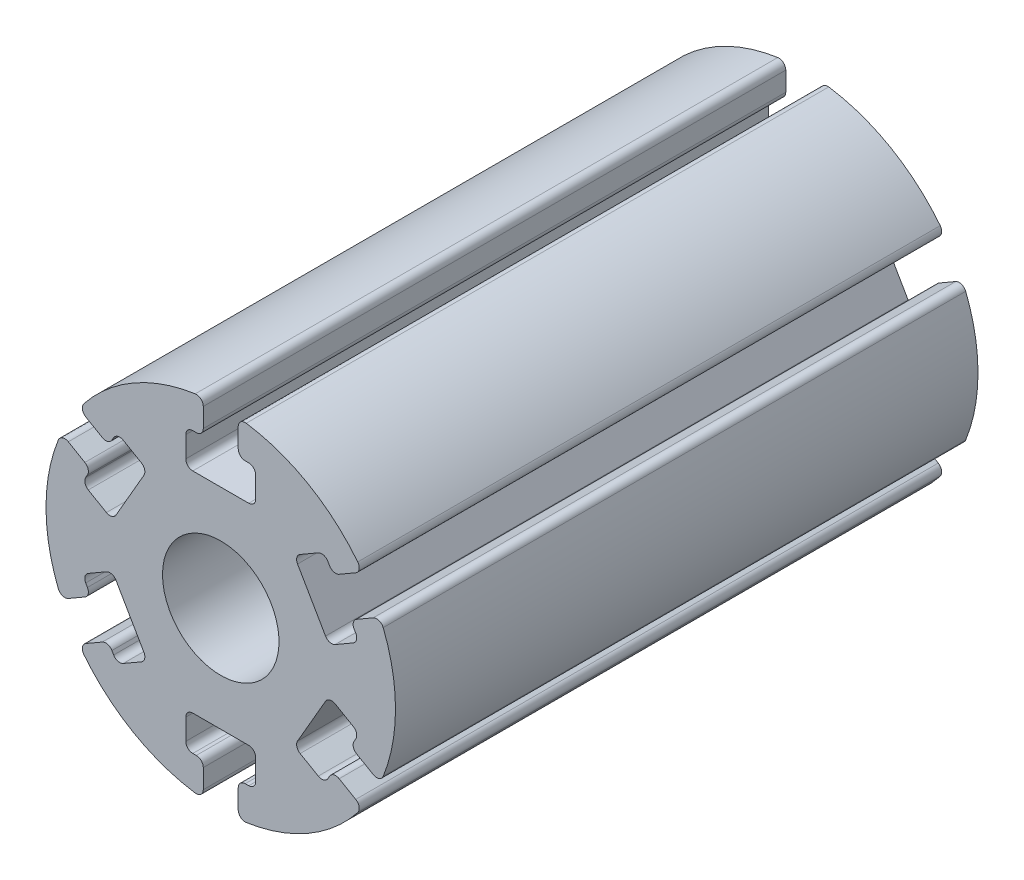
from build123d import *

# Parameters (mm, degrees)
ESBO_O1_R                = 7.5
RESSALTO_EXTRUS_O1_DEPTH = 12.5
ESBO_O7_R                = 2.5
CORTE_EXTRUS_O1_DEPTH    = 16
CORTE_EXTRUS_O2_DEPTH    = 28.156951228
FILETE2_R                = 0.3


with BuildPart() as part:
    # Esboço1 → Ressalto-extrusão1 (new, symmetric)
    with BuildSketch(Plane.XY):
        Circle(ESBO_O1_R)
    extrude(amount=RESSALTO_EXTRUS_O1_DEPTH, both=True)

    # Esboço7 → Corte-extrusão1 (cut)
    with BuildSketch(Plane(origin=(0, 0, 12.5), x_dir=(-1, 0, 0), z_dir=(0, 0, -1))):
        Circle(ESBO_O7_R)
    extrude(amount=CORTE_EXTRUS_O1_DEPTH, mode=Mode.SUBTRACT)

    # Esboço9 → Corte-extrusão2 (cut, through all)
    with BuildSketch(Plane.XY.offset(12.5)):
        Polygon((-0.75, 6), (-0.75, 7.5), (0.75, 7.5), (0.75, 6), (1.5, 6), (1.5, 4.5), (-1.5, 4.5), (-1.5, 6), align=None)
        Polygon((4.446152423, 4.299038106), (3.147114317, 3.549038106), (4.647114317, 0.950961894), (5.946152423, 1.700961894), (5.571152423, 2.350480947), (6.870190528, 3.100480947), (6.120190528, 4.399519053), (4.821152423, 3.649519053), align=None)
        Polygon((5.946152423, -1.700961894), (4.647114317, -0.950961894), (3.147114317, -3.549038106), (4.446152423, -4.299038106), (4.821152423, -3.649519053), (6.120190528, -4.399519053), (6.870190528, -3.100480947), (5.571152423, -2.350480947), align=None)
        Polygon((1.5, -6), (1.5, -4.5), (-1.5, -4.5), (-1.5, -6), (-0.75, -6), (-0.75, -7.5), (0.75, -7.5), (0.75, -6), align=None)
        Polygon((-4.446152423, -4.299038106), (-3.147114317, -3.549038106), (-4.647114317, -0.950961894), (-5.946152423, -1.700961894), (-5.571152423, -2.350480947), (-6.870190528, -3.100480947), (-6.120190528, -4.399519053), (-4.821152423, -3.649519053), align=None)
        Polygon((-5.946152423, 1.700961894), (-4.647114317, 0.950961894), (-3.147114317, 3.549038106), (-4.446152423, 4.299038106), (-4.821152423, 3.649519053), (-6.120190528, 4.399519053), (-6.870190528, 3.100480947), (-5.571152423, 2.350480947), align=None)
    extrude(amount=-CORTE_EXTRUS_O2_DEPTH, mode=Mode.SUBTRACT)

    # Filete2
    filete2_edges = [part.edges().sort_by_distance(p)[0] for p in [
        (-6.837632977, -3.081683836, 0),
        (-6.087632977, -4.380721942, 0),
        (-4.821152423, -3.649519053, 0),
        (-5.571152423, -2.350480947, 0),
        (-5.946152423, -1.700961894, 0),
        (-4.647114317, -0.950961894, 0),
        (-3.147114317, -3.549038106, 0),
        (-4.446152423, -4.299038106, 0),
        (-0.75, -7.462405778, 0),
        (0.75, -7.462405778, 0),
        (0.75, -6, 0),
        (-0.75, -6, 0),
        (-1.5, -6, 0),
        (-1.5, -4.5, 0),
        (1.5, -4.5, 0),
        (1.5, -6, 0),
        (6.087632977, -4.380721942, 0),
        (6.837632977, -3.081683836, 0),
        (5.571152423, -2.350480947, 0),
        (4.821152423, -3.649519053, 0),
        (4.446152423, -4.299038106, 0),
        (3.147114317, -3.549038106, 0),
        (4.647114317, -0.950961894, 0),
        (5.946152423, -1.700961894, 0),
        (6.837632977, 3.081683836, 0),
        (6.087632977, 4.380721942, 0),
        (4.821152423, 3.649519053, 0),
        (5.571152423, 2.350480947, 0),
        (5.946152423, 1.700961894, 0),
        (4.647114317, 0.950961894, 0),
        (3.147114317, 3.549038106, 0),
        (4.446152423, 4.299038106, 0),
        (0.75, 7.462405778, 0),
        (-0.75, 7.462405778, 0),
        (-0.75, 6, 0),
        (0.75, 6, 0),
        (1.5, 6, 0),
        (1.5, 4.5, 0),
        (-1.5, 4.5, 0),
        (-1.5, 6, 0),
        (-6.087632977, 4.380721942, 0),
        (-6.837632977, 3.081683836, 0),
        (-5.571152423, 2.350480947, 0),
        (-4.821152423, 3.649519053, 0),
        (-4.446152423, 4.299038106, 0),
        (-3.147114317, 3.549038106, 0),
        (-4.647114317, 0.950961894, 0),
        (-5.946152423, 1.700961894, 0),
    ]]
    fillet(filete2_edges, radius=FILETE2_R)


solid = part.part
